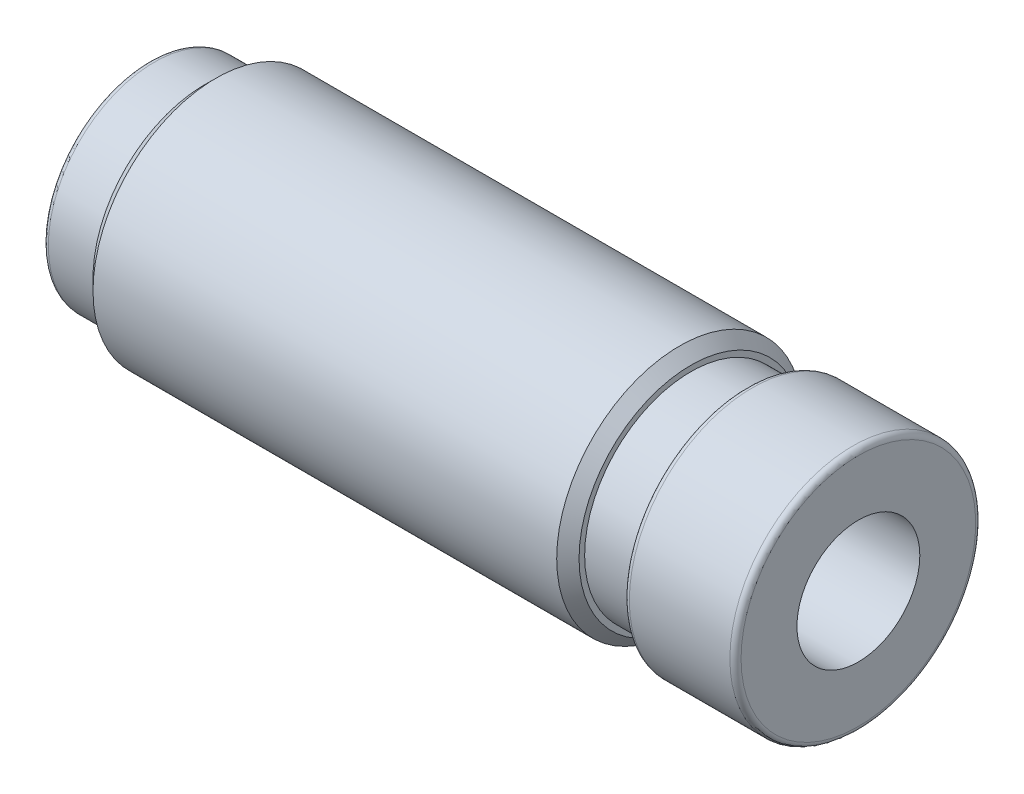
from build123d import *

# Parameters (mm, degrees)
FURO1_D       = 11
FURO1_DEPTH   = 55.7
FURO2_D       = 9.4
FURO2_DEPTH   = 8
FILETE2_R     = 0.5
FILETE3_R     = 0.5
FILETE4_R     = 0.5
CHANFRO1_SIZE = 1


with BuildPart() as part:
    # Esboço1 → Revolução1 (revolve)
    with BuildSketch(Plane.XY, mode=Mode.PRIVATE) as revolu_o1_sk:
        Polygon((0, 0), (63.5, 0), (63.5, 11), (53.5, 11), (53.5, 9.5), (48.5, 9.5), (48.5, 11), (5, 11), (5, 9.5), (0, 9.5), align=None)
    revolve(revolu_o1_sk.sketch.rotate(Axis((0, 0, 0), (1, 0, 0)), 90), axis=Axis((0, 0, 0), (1, 0, 0)))

    # Furo1
    with Locations(Plane(origin=(63.5, 0, 0), x_dir=(0, 0, -1), z_dir=(1, 0, 0))):
        with Locations((0, 0)):
            Hole(FURO1_D / 2, depth=FURO1_DEPTH)

    # Furo2
    with Locations(Plane.ZY):
        with Locations((0, 0)):
            Hole(FURO2_D / 2, depth=FURO2_DEPTH)

    # Filete2
    filete2_edges = [part.edges().sort_by_distance(p)[0] for p in [
        (63.5, 0, -11),
        (53.5, 0, -11),
    ]]
    fillet(filete2_edges, radius=FILETE2_R)

    # Filete3
    filete3_edges = [part.edges().sort_by_distance(p)[0] for p in [
        (0, 0, 4.7),
    ]]
    fillet(filete3_edges, radius=FILETE3_R)

    # Filete4
    filete4_edges = [part.edges().sort_by_distance(p)[0] for p in [
        (0, 0, -9.5),
    ]]
    fillet(filete4_edges, radius=FILETE4_R)

    # Chanfro1
    chanfro1_edges = [part.edges().sort_by_distance(p)[0] for p in [
        (5, 0, -11),
        (48.5, 0, -11),
    ]]
    chamfer(chanfro1_edges, length=CHANFRO1_SIZE)


solid = part.part
